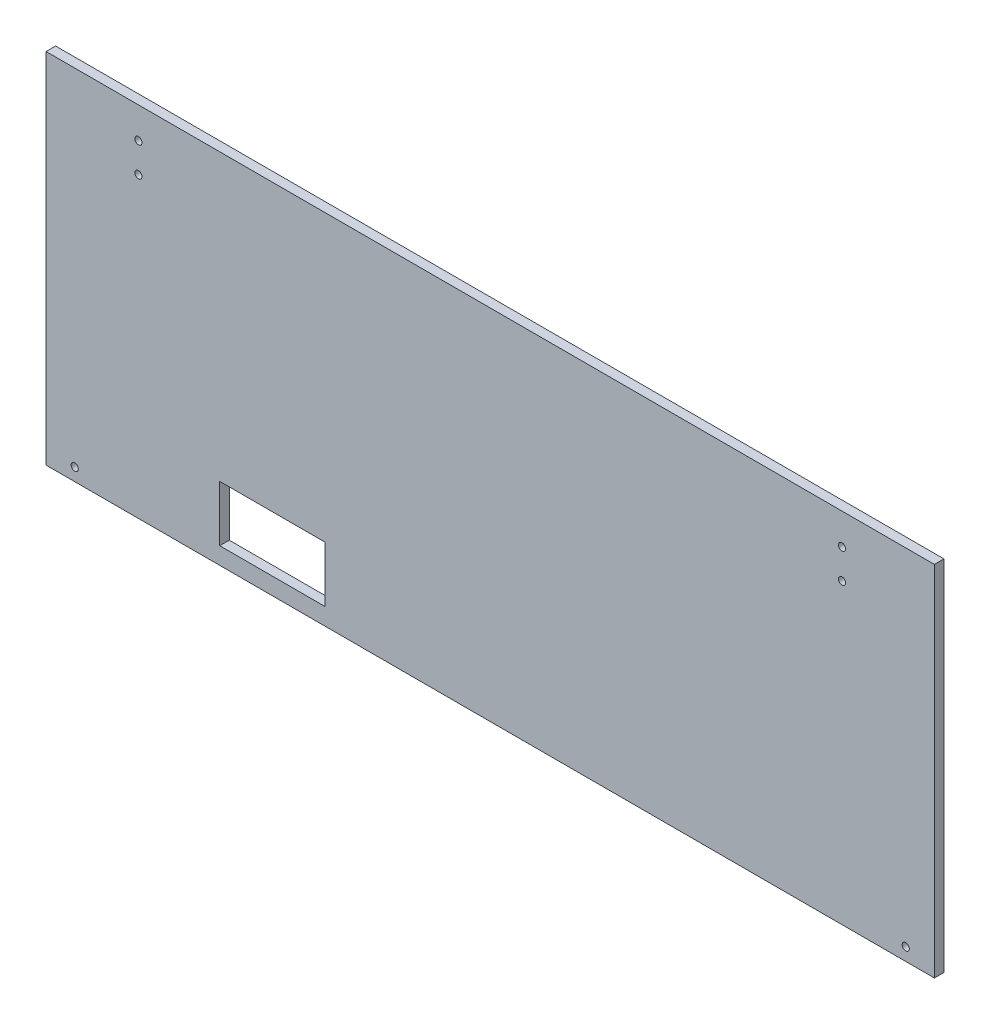
from build123d import *

# Parameters (mm, degrees)
SCHIZZO1_W                   = 558
SCHIZZO1_H                   = 225
ESTRUSIONE_ESTRUSIONE1_DEPTH = 6
SCHIZZO2_R                   = 2.25
SCHIZZO2_W                   = 66
SCHIZZO2_H                   = 35
TAGLIO_ESTRUSIONE1_DEPTH     = 10


with BuildPart() as part:
    # Schizzo1 → Estrusione-Estrusione1 (new body)
    with BuildSketch(Plane.XY):
        Rectangle(SCHIZZO1_W, SCHIZZO1_H)
    extrude(amount=ESTRUSIONE_ESTRUSIONE1_DEPTH)

    # Schizzo2 → Taglio-Estrusione1 (cut)
    with BuildSketch(Plane(origin=(0, 0, 0), x_dir=(-1, 0, 0), z_dir=(0, 0, -1))):
        with Locations((-221, 93)):
            Circle(SCHIZZO2_R)
        with Locations((-221, 74.5)):
            Circle(SCHIZZO2_R)
        with Locations((221, 93)):
            Circle(SCHIZZO2_R)
        with Locations((221, 74.5)):
            Circle(SCHIZZO2_R)
        with Locations((-261, -104.5)):
            Circle(SCHIZZO2_R)
        with Locations((261, -104.5)):
            Circle(SCHIZZO2_R)
        with Locations((136.925688, -84.3)):
            Rectangle(SCHIZZO2_W, SCHIZZO2_H)
    extrude(amount=-TAGLIO_ESTRUSIONE1_DEPTH, mode=Mode.SUBTRACT)


solid = part.part
